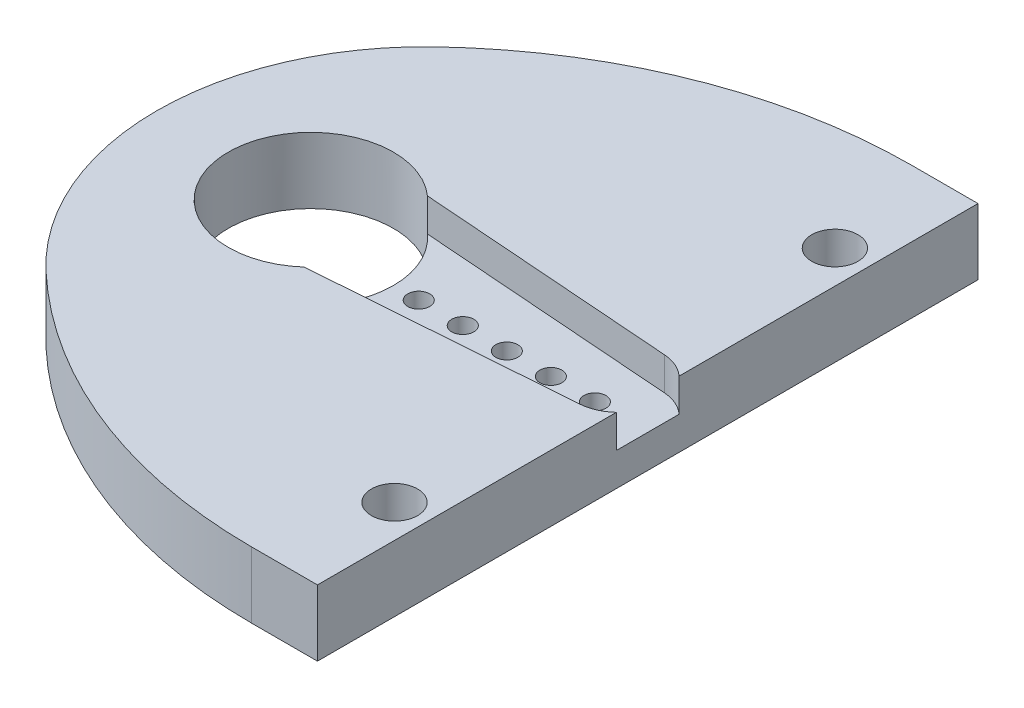
from build123d import *

# Parameters (mm, degrees)
SKETCH1_R               = 1.05
SKETCH1_R_2             = 2.35
BOSS_EXTRUDE1_DEPTH     = 3
ENL_V_MAT_EXTRU_1_DEPTH = 1.5
ESQUISSE3_R             = 0.5
ESQUISSE3_R_2           = 3.75
ENL_V_MAT_EXTRU_7_DEPTH = 22.478826932


with BuildPart() as part:
    # Sketch1 → Boss-Extrude1 (new body)
    with BuildSketch(Plane(origin=(0, 0, 0), x_dir=(1, 0, 0), z_dir=(0, 1, 0))):
        with BuildLine():
            Line((15.3, 15), (12.3, 15))
            ThreePointArc((12.3, 15), (3.958234572, 13.40032808), (-3.2, 8.828273999))
            ThreePointArc((-3.2, 8.828273999), (-7, 0), (-3.2, -8.828273999))
            ThreePointArc((-3.2, -8.828273999), (3.958234572, -13.40032808), (12.3, -15))
            Line((12.3, -15), (15.3, -15))
            Line((15.3, -15), (15.3, 15))
        make_face()
        with Locations(Location((13.8, -10, 0), (0, 0, 270))):
            Circle(SKETCH1_R, mode=Mode.SUBTRACT)
        with Locations(Location((13.8, 10, 0), (0, 0, 270))):
            Circle(SKETCH1_R, mode=Mode.SUBTRACT)
        with Locations(Location((0, 0, 0), (0, 0, 270))):
            Circle(SKETCH1_R_2, mode=Mode.SUBTRACT)
    extrude(amount=-BOSS_EXTRUDE1_DEPTH)

    # Esquisse1 → Enlèv. mat.-Extru.1 (cut)
    with BuildSketch(Plane(origin=(0, 0, 0), x_dir=(1, 0, 0), z_dir=(0, 1, 0))):
        with BuildLine():
            Line((2.494493937, -2.8), (14.131406802, -1.932309126))
            add(Edge.make_bspline(
                [(14.131406802, -1.932309126), (14.497286128, -1.904835216), (14.827491954, -1.746052706), (15.157338026, -1.587443187), (15.407154881, -1.318584734), (15.656200737, -1.050556048), (15.790562016, -0.709168668), (15.92490372, -0.367831024), (15.925, 0), (15.925095847, 0.366175279), (15.791018176, 0.708007672), (15.657374187, 1.048734388), (15.407835717, 1.317851242), (15.159067388, 1.586137532), (14.828615817, 1.74551148), (14.498449498, 1.904747853), (14.131406802, 1.932309126)],
                knots=[0, 0, 0, 0.125, 0.125, 0.25, 0.25, 0.375, 0.375, 0.5, 0.5, 0.625, 0.625, 0.75, 0.75, 0.875, 0.875, 1, 1, 1], degree=2))
            Line((14.131406802, 1.932309126), (2.494493937, 2.8))
            ThreePointArc((2.494493937, 2.8), (-3.75, 0), (2.494493937, -2.8))
        make_face()
    extrude(amount=-ENL_V_MAT_EXTRU_1_DEPTH, mode=Mode.SUBTRACT)

    # Esquisse3 → Enlèv. mat.-Extru.7 (cut, through all)
    with BuildSketch(Plane(origin=(0, -1.5, 0), x_dir=(1, 0, 0), z_dir=(0, 1, 0))):
        with Locations(Location((4.9, 0, 0), (0, 0, 270))):
            Circle(ESQUISSE3_R)
        with Locations(Location((6.9, 0, 0), (0, 0, 270))):
            Circle(ESQUISSE3_R)
        with Locations(Location((8.9, 0, 0), (0, 0, 270))):
            Circle(ESQUISSE3_R)
        with Locations(Location((10.9, 0, 0), (0, 0, 270))):
            Circle(ESQUISSE3_R)
        with Locations(Location((12.9, 0, 0), (0, 0, 270))):
            Circle(ESQUISSE3_R)
        with Locations(Location((0, 0, 0), (0, 0, 270))):
            Circle(ESQUISSE3_R_2)
    extrude(amount=-ENL_V_MAT_EXTRU_7_DEPTH, mode=Mode.SUBTRACT)


solid = part.part
